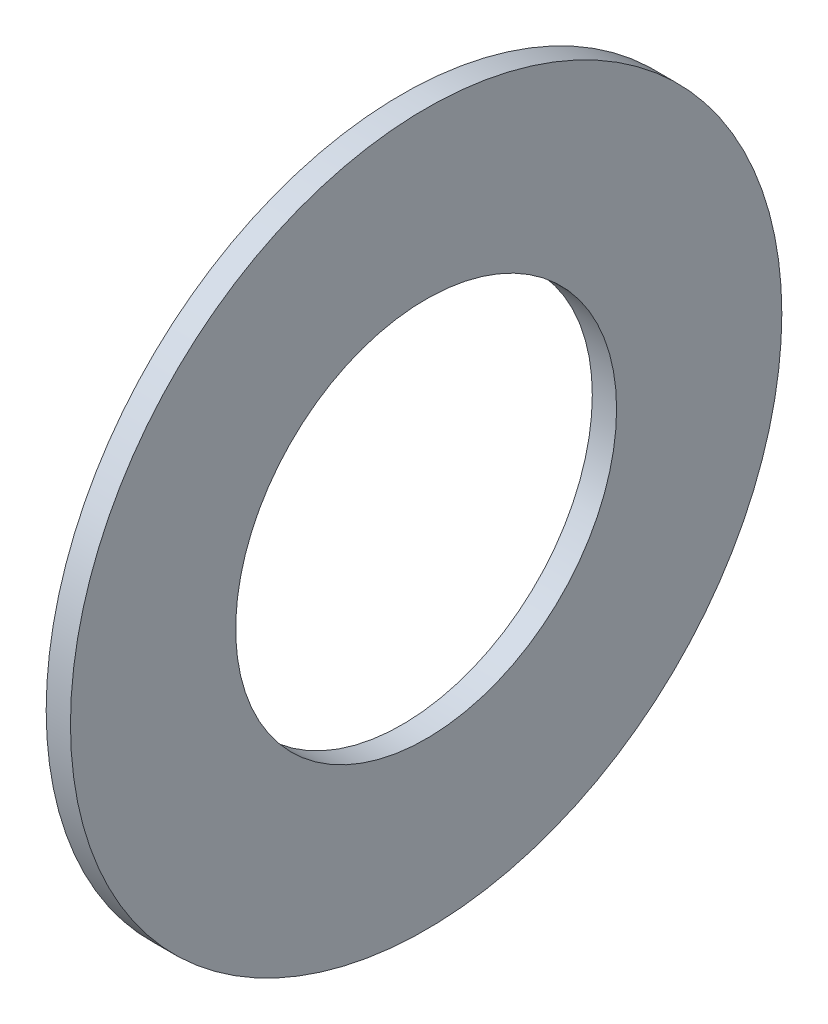
from build123d import *

# Parameters (mm, degrees)
SKETCH5_R           = 11.90625
SKETCH5_R_2         = 6.3754
BOSS_EXTRUDE1_DEPTH = 0.4064


with BuildPart() as part:
    # Sketch5 → Boss-Extrude1 (new, symmetric)
    with BuildSketch(Plane(origin=(0, 0, 0), x_dir=(0, 0, -1), z_dir=(1, 0, 0))):
        Circle(SKETCH5_R)
        Circle(SKETCH5_R_2, mode=Mode.SUBTRACT)
    extrude(amount=BOSS_EXTRUDE1_DEPTH, both=True)


solid = part.part
